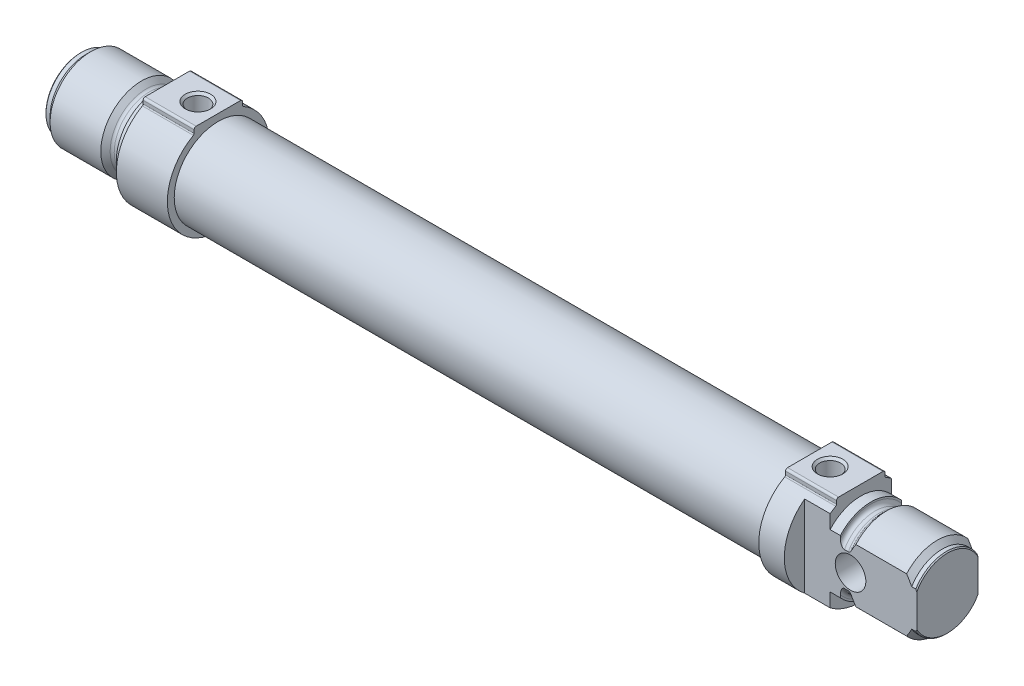
from build123d import *

# Parameters (mm, degrees)
AUFSATZ_LINEAR_AUSTRAGEN1_DEPTH      = 10
SKIZZE3_W                            = 116
SKIZZE3_H                            = 8.65
AUFSATZ_LINEAR_AUSTRAGEN2_DEPTH      = 10
SCHNITT_LINEAR_AUSTRAGEN1_DEPTH      = 10
SCHNITT_LINEAR_AUSTRAGEN1_DEPTH_BACK = 10
BOHRUNG1_D                           = 6
BOHRUNG2_D                           = 4.134
BOHRUNG2_DEPTH                       = 10
BOHRUNG2_CSINK_D                     = 5
BOHRUNG2_CSINK_ANGLE                 = 90
BOHRUNG3_D                           = 4.134
BOHRUNG3_DEPTH                       = 11
BOHRUNG3_CSINK_D                     = 5
BOHRUNG3_CSINK_ANGLE                 = 90
BOHRUNG3_TIP                         = 1.193383006


with BuildPart() as part:
    # Skizze1 → Rotation1 (revolve)
    with BuildSketch(Plane.XY):
        with BuildLine():
            Line((0, 0), (0, 6.8))
            Line((0, 6.8), (0.2, 7))
            Line((0.2, 7), (1, 7))
            Line((1, 7), (2, 8))
            Line((2, 8), (11.95, 8))
            Line((11.95, 8), (12.865685425, 7.084314575))
            ThreePointArc((12.865685425, 7.084314575), (13.125224104, 6.910896374), (13.43137085, 6.85))
            Line((13.43137085, 6.85), (14.2, 6.85))
            ThreePointArc((14.2, 6.85), (14.765685425, 7.084314575), (15, 7.65))
            Line((15, 7.65), (15, 8))
            Line((15, 8), (17, 8))
            Line((17, 8), (17, 0))
            Line((17, 0), (0, 0))
        make_face()
    revolve(axis=Axis((17, 0, 0), (-1, 0, 0)))

    # Skizze2 → Aufsatz-Linear austragen1 (add)
    with BuildSketch(Plane(origin=(17, 0, 0), x_dir=(0, 0, -1), z_dir=(1, 0, 0))):
        with BuildLine():
            Line((4.75, 8.977054082), (4.75, 9.6))
            ThreePointArc((4.75, 9.6), (4.632842712, 9.882842712), (4.35, 10))
            Line((4.35, 10), (-4.35, 10))
            ThreePointArc((-4.35, 10), (-4.632842712, 9.882842712), (-4.75, 9.6))
            Line((-4.75, 9.6), (-4.75, 8.977054082))
            ThreePointArc((-4.75, 8.977054082), (-4.791034545, 8.825604773), (-4.902912621, 8.715586488))
            ThreePointArc((-4.902912621, 8.715586488), (0, -10), (4.902912621, 8.715586488))
            ThreePointArc((4.902912621, 8.715586488), (4.791034545, 8.825604773), (4.75, 8.977054082))
        make_face()
    extrude(amount=AUFSATZ_LINEAR_AUSTRAGEN1_DEPTH)

    # Skizze3 → Rotation2 (revolve)
    with BuildSketch(Plane.XY):
        with Locations((85, 4.325)):
            Rectangle(SKIZZE3_W, SKIZZE3_H)
    revolve(axis=Axis((143, 0, 0), (-1, 0, 0)))

    # Skizze4 → Aufsatz-Linear austragen2 (add)
    with BuildSketch(Plane(origin=(143, 0, 0), x_dir=(0, 0, -1), z_dir=(1, 0, 0))):
        with BuildLine():
            Line((4.75, 8.977054082), (4.75, 9.6))
            ThreePointArc((4.75, 9.6), (4.632842712, 9.882842712), (4.35, 10))
            Line((4.35, 10), (-4.35, 10))
            ThreePointArc((-4.35, 10), (-4.632842712, 9.882842712), (-4.75, 9.6))
            Line((-4.75, 9.6), (-4.75, 8.977054082))
            ThreePointArc((-4.75, 8.977054082), (-4.791034545, 8.825604773), (-4.902912621, 8.715586488))
            ThreePointArc((-4.902912621, 8.715586488), (0, -10), (4.902912621, 8.715586488))
            ThreePointArc((4.902912621, 8.715586488), (4.791034545, 8.825604773), (4.75, 8.977054082))
        make_face()
    extrude(amount=AUFSATZ_LINEAR_AUSTRAGEN2_DEPTH)

    # Skizze5 → Rotation3 (revolve)
    with BuildSketch(Plane.XY):
        with BuildLine():
            Line((153, 0), (153, 8))
            Line((153, 8), (155, 8))
            Line((155, 8), (155, 7.65))
            ThreePointArc((155, 7.65), (155.234314575, 7.084314575), (155.8, 6.85))
            Line((155.8, 6.85), (156.56862915, 6.85))
            ThreePointArc((156.56862915, 6.85), (156.874775896, 6.910896374), (157.134314575, 7.084314575))
            Line((157.134314575, 7.084314575), (158.05, 8))
            Line((158.05, 8), (168, 8))
            Line((168, 8), (169, 7))
            Line((169, 7), (169.8, 7))
            Line((169.8, 7), (170, 6.8))
            Line((170, 6.8), (170, 0))
            Line((170, 0), (153, 0))
        make_face()
    revolve(axis=Axis((170, 0, 0), (-1, 0, 0)))

    # Skizze6 → Schnitt-Linear austragen1 (cut, two sides: drawn at the far end of the back side and taken through both)
    with BuildSketch(Plane(origin=(0, 0, 0), x_dir=(1, 0, 0), z_dir=(0, 1, 0)).offset(-SCHNITT_LINEAR_AUSTRAGEN1_DEPTH_BACK)):
        Polygon((148, 18), (148, 6), (170, 6), (170, -6), (148, -6), (148, -18), (182, -18), (182, 18), align=None)
    extrude(amount=SCHNITT_LINEAR_AUSTRAGEN1_DEPTH + SCHNITT_LINEAR_AUSTRAGEN1_DEPTH_BACK, mode=Mode.SUBTRACT)

    # Bohrung1 (through all)
    with Locations(Plane(origin=(0, 0, -6), x_dir=(-1, 0, 0), z_dir=(0, 0, -1))):
        with Locations((-157, 0)):
            Hole(BOHRUNG1_D / 2)

    # Bohrung2
    with Locations(Plane(origin=(0, 10, 0), x_dir=(1, 0, 0), z_dir=(0, 1, 0))):
        with Locations((23, 0)):
            CounterSinkHole(BOHRUNG2_D / 2, BOHRUNG2_CSINK_D / 2, depth=BOHRUNG2_DEPTH, counter_sink_angle=BOHRUNG2_CSINK_ANGLE)

    # Bohrung3
    with Locations(Plane(origin=(0, 10, 0), x_dir=(1, 0, 0), z_dir=(0, 1, 0))):
        with Locations((147, 0)):
            CounterSinkHole(BOHRUNG3_D / 2, BOHRUNG3_CSINK_D / 2, depth=BOHRUNG3_DEPTH, counter_sink_angle=BOHRUNG3_CSINK_ANGLE)
            with Locations((0, 0, -(BOHRUNG3_DEPTH + BOHRUNG3_TIP / 2))):  # 120° drill point
                Cone(0, BOHRUNG3_D / 2, BOHRUNG3_TIP, mode=Mode.SUBTRACT)

    # Skizze13 → Schnitt-Rotation1 (revolve, cut)
    with BuildSketch(Plane.XY):
        Polygon((-5, 0), (-5, 3), (41.2, 3), (41.2, 8), (125.2, 8), (125.2, 0), align=None)
    revolve(axis=Axis((125.2, 0, 0), (-1, 0, 0)), mode=Mode.SUBTRACT)


solid = part.part
